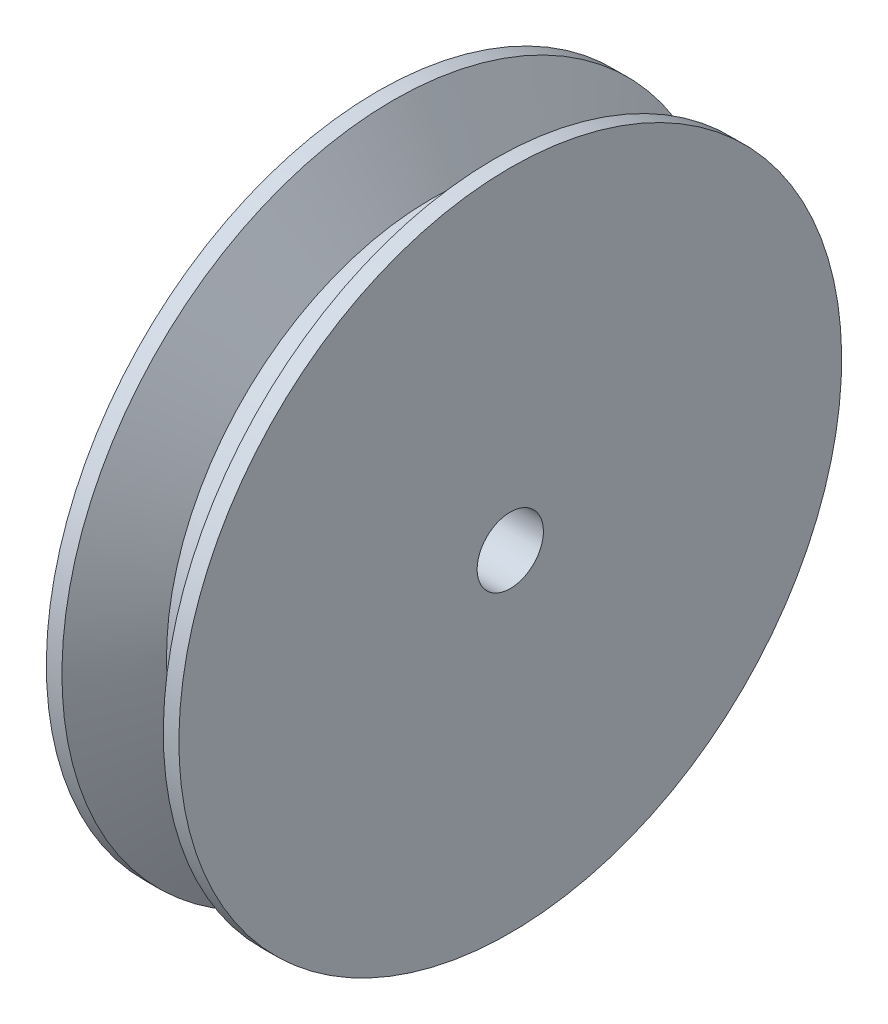
from build123d import *

# Parameters (mm, degrees)
SKETCH2_R               = 5
BOSS_EXTRUDE1_DEPTH     = 6
SKETCH3_R               = 2
CUT_EXTRUDE1_DEPTH      = 32.559467676
FILLET1_R               = 0.5
CUT_EXTRUDE2_DEPTH      = 31
CUT_EXTRUDE2_DEPTH_BACK = 31
SKETCH4_R               = 1


with BuildPart() as part:
    # Sketch1 → Revolve1 (revolve)
    with BuildSketch(Plane.XY):
        Polygon((-3.059401077, 20), (-0.75, 16), (0.75, 16), (3.059401077, 20), (4, 20), (4, 0), (-4, 0), (-4, 20), align=None)
    revolve(axis=Axis((4, 0, 0), (-1, 0, 0)))

    # Sketch2 → Boss-Extrude1 (add)
    with BuildSketch(Plane.ZY.offset(4)):
        with Locations(Location((0, 0, 0), (0, 0, 270))):
            Circle(SKETCH2_R)
    extrude(amount=BOSS_EXTRUDE1_DEPTH)

    # Sketch3 → Cut-Extrude1 (cut, through all)
    with BuildSketch(Plane.ZY.offset(10)):
        with Locations(Location((0, 0, 0), (0, 0, 270))):
            Circle(SKETCH3_R)
    extrude(amount=-CUT_EXTRUDE1_DEPTH, mode=Mode.SUBTRACT)

    # Fillet1
    fillet1_edges = [part.edges().sort_by_distance(p)[0] for p in [
        (-4, 5, 0),
        (-10, 5, 0),
    ]]
    fillet(fillet1_edges, radius=FILLET1_R)

    # Sketch4 → Cut-Extrude2 (cut, two sides: drawn at the far end of the back side and taken through both)
    with BuildSketch(Plane.XY.offset(-CUT_EXTRUDE2_DEPTH_BACK)):
        with Locations((-7, 0)):
            Circle(SKETCH4_R)
    extrude(amount=CUT_EXTRUDE2_DEPTH + CUT_EXTRUDE2_DEPTH_BACK, mode=Mode.SUBTRACT)


solid = part.part
